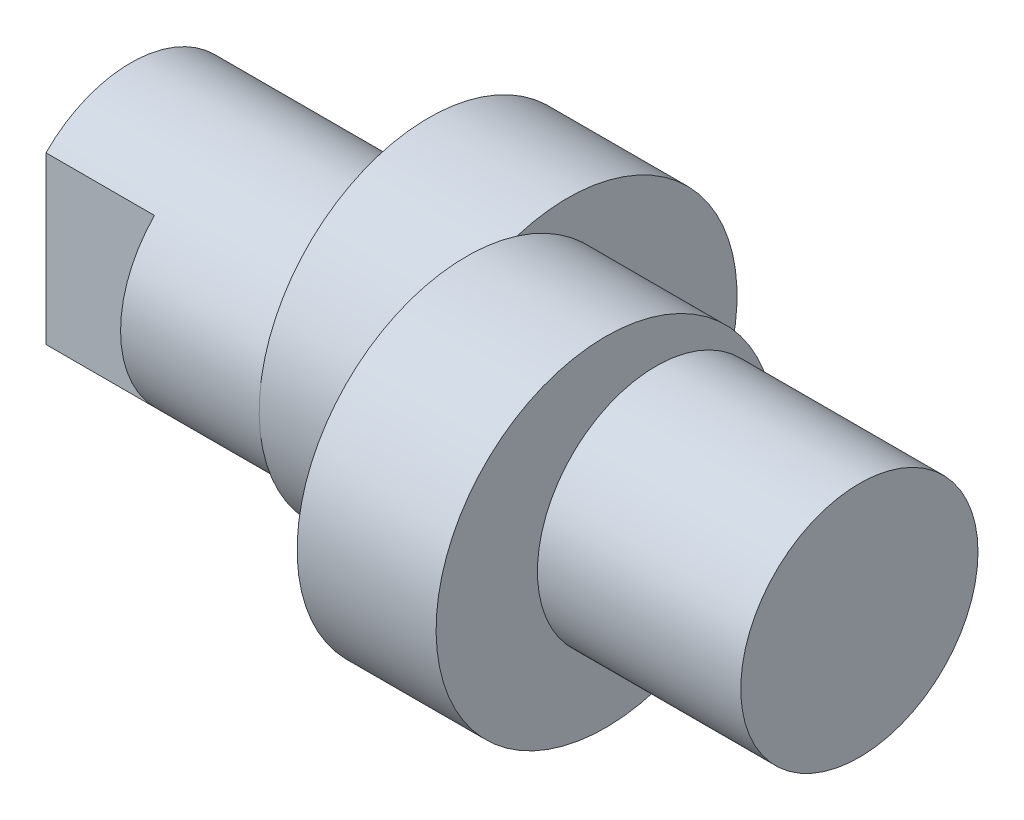
from build123d import *

# Parameters (mm, degrees)
SKETCH_1_R          = 3.5
EXTRUDE_1_DEPTH     = 7.3
SKETCH_2_R          = 5
EXTRUDE_2_DEPTH     = 4.1
SKETCH_3_R          = 5
EXTRUDE_3_DEPTH     = 4.1
EXTRUDE_START       = 6
SKETCH_4_R          = 3.5
EXTRUDE_4_DEPTH     = 6
CUT_EXTRUDE_START   = -3.2
CUT_EXTRUDE_1_DEPTH = 3.2


with BuildPart() as part:
    # 草图1 → 凸台-拉伸1 (new body)
    with BuildSketch(Plane(origin=(0, 0, 0), x_dir=(0, 0, -1), z_dir=(1, 0, 0))):
        Circle(SKETCH_1_R)
    extrude(amount=-EXTRUDE_1_DEPTH)

    # 草图2 → 凸台-拉伸2 (add)
    with BuildSketch(Plane(origin=(0, 0, 0), x_dir=(0, 0, -1), z_dir=(1, 0, 0))):
        with Locations((1.49, 0)):
            Circle(SKETCH_2_R)
    extrude(amount=EXTRUDE_2_DEPTH)

    # 草图3 → 凸台-拉伸3 (add)
    with BuildSketch(Plane(origin=(4.1, 0, 0), x_dir=(0, 0, -1), z_dir=(1, 0, 0))):
        with Locations(Location((-1.49, 0, 0), (0, 0, 287.337518018))):
            Circle(SKETCH_3_R)
    extrude(amount=EXTRUDE_3_DEPTH)

    # 草图4 → 凸台-拉伸4 (add)
    with BuildSketch(Plane(origin=(8.2, 0, 0), x_dir=(0, 0, -1), z_dir=(1, 0, 0)).offset(EXTRUDE_START)):
        Circle(SKETCH_4_R)
    extrude(amount=-EXTRUDE_4_DEPTH)

    # 草图7 → 切除-拉伸1 (cut)
    with BuildSketch(Plane.ZY.offset(7.3).offset(CUT_EXTRUDE_START)):
        with BuildLine():
            Line((-2.5, 0), (-3.5, 0))
            ThreePointArc((-3.5, 0), (-3.240370349, -1.322875656), (-2.5, -2.449489743))
            Line((-2.5, -2.449489743), (-2.5, 0))
        make_face()
        with BuildLine():
            ThreePointArc((-2.5, 2.449489743), (-3.240370349, 1.322875656), (-3.5, 0))
            Line((-3.5, 0), (-2.5, 0))
            Line((-2.5, 0), (-2.5, 2.449489743))
        make_face()
        with BuildLine():
            Line((2.5, 0), (2.5, -2.449489743))
            ThreePointArc((2.5, -2.449489743), (3.240370349, -1.322875656), (3.5, 0))
            Line((3.5, 0), (2.5, 0))
        make_face()
        with BuildLine():
            ThreePointArc((3.5, 0), (3.240370349, 1.322875656), (2.5, 2.449489743))
            Line((2.5, 2.449489743), (2.5, 0))
            Line((2.5, 0), (3.5, 0))
        make_face()
    extrude(amount=CUT_EXTRUDE_1_DEPTH, mode=Mode.SUBTRACT)


solid = part.part
